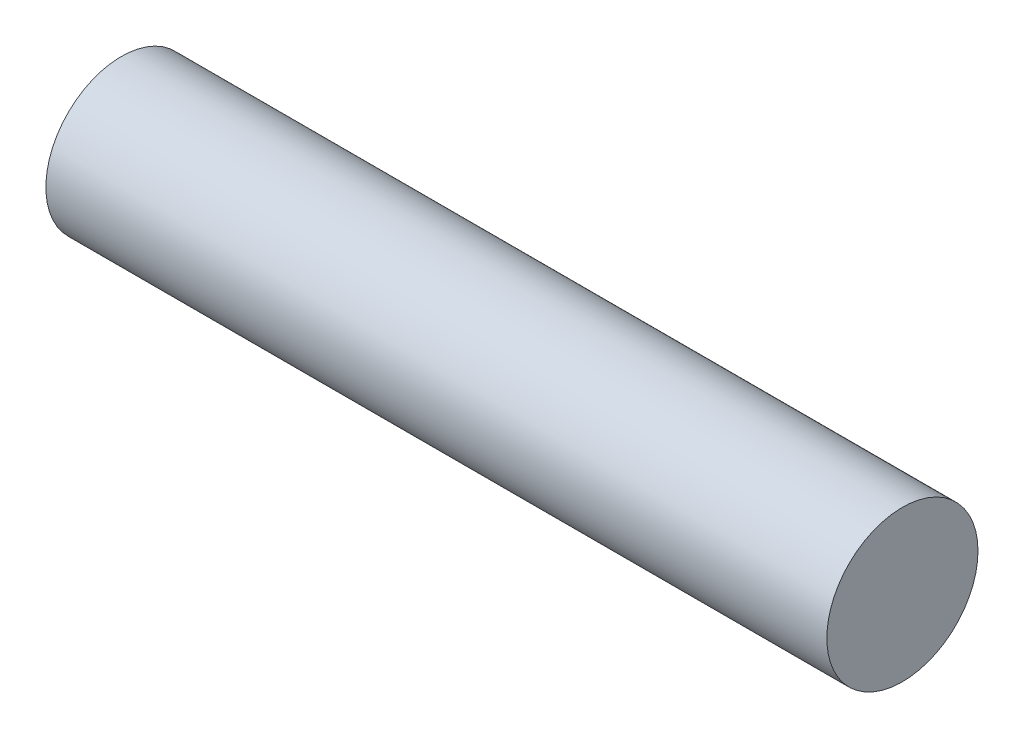
from build123d import *

# Parameters (mm, degrees)
SKETCH1_R           = 6
BOSS_EXTRUDE1_DEPTH = 62


with BuildPart() as part:
    # Sketch1 → Boss-Extrude1 (new body)
    with BuildSketch(Plane(origin=(0, 0, 0), x_dir=(0, 0, -1), z_dir=(1, 0, 0))):
        Circle(SKETCH1_R)
    extrude(amount=BOSS_EXTRUDE1_DEPTH)


solid = part.part
